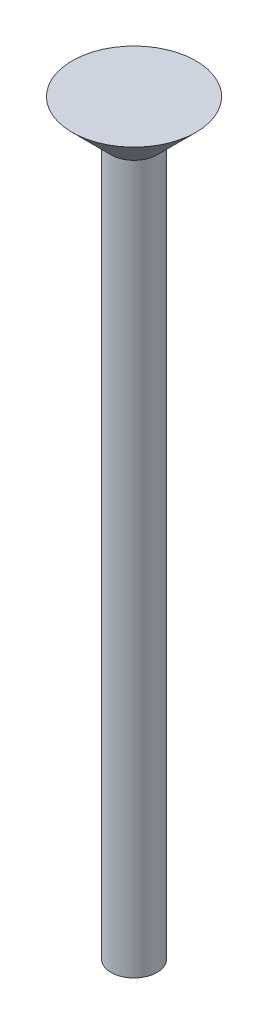
from build123d import *


with BuildPart() as part:
    # Sketch1 → Revolve1 (revolve)
    with BuildSketch(Plane.XY):
        Polygon((8.30929368, 32.741921933), (8.30929368, -18.058078067), (6.65829368, -18.058078067), (6.65829368, 35.535921933), (11.10329368, 35.535921933), align=None)
    revolve(axis=Axis((6.65829368, -18.058078067, 0), (0, 1, 0)))


solid = part.part
